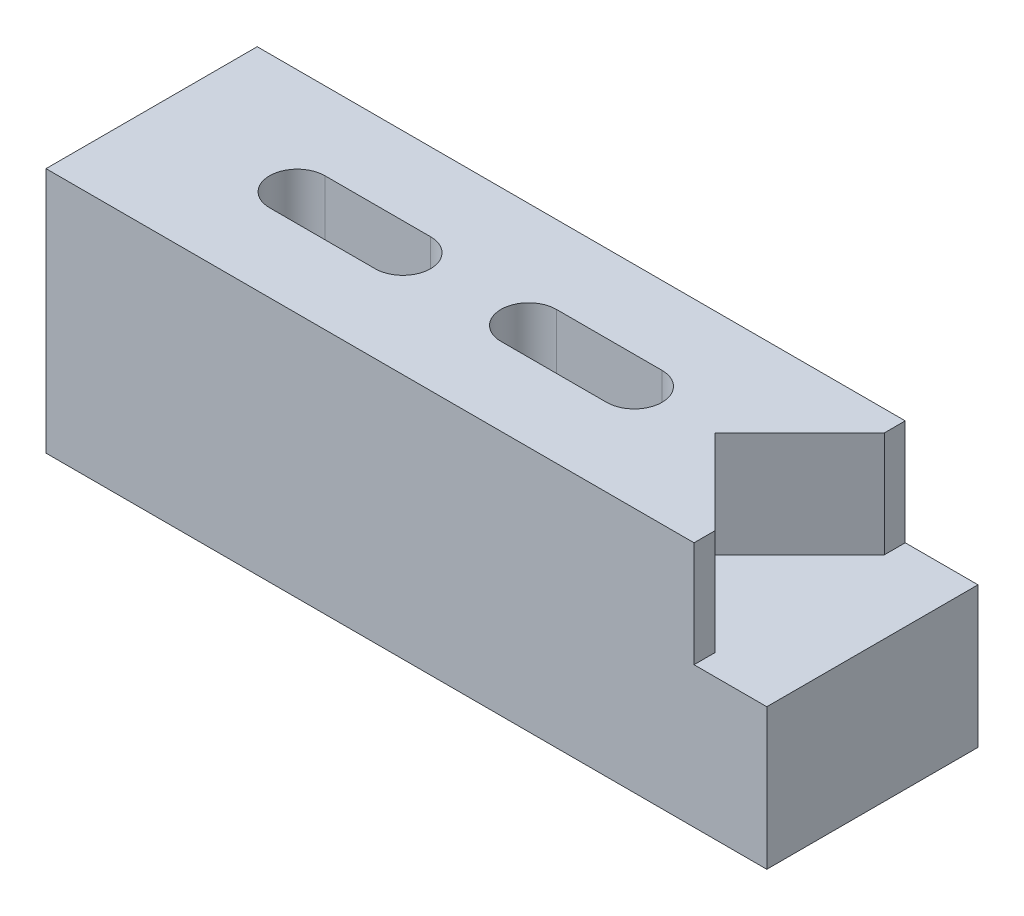
from build123d import *

# Parameters (mm, degrees)
SKETCH1_W           = 48.26
SKETCH1_H           = 17.78
BOSS_EXTRUDE1_DEPTH = 15.24
CUT_EXTRUDE1_DEPTH  = 7.62
CUT_EXTRUDE2_DEPTH  = 54.641528688
SKETCH5_W           = 15.24
SKETCH5_H           = 10.16
BOSS_EXTRUDE2_DEPTH = 3.75
CUT_EXTRUDE5_DEPTH  = 7.62
CUT_EXTRUDE7_DEPTH  = 7.62


with BuildPart() as part:
    # Sketch1 → Boss-Extrude1 (new body)
    with BuildSketch(Plane.XY):
        with Locations((24.13, 8.89)):
            Rectangle(SKETCH1_W, SKETCH1_H)
    extrude(amount=-BOSS_EXTRUDE1_DEPTH)

    # Sketch3 → Cut-Extrude1 (cut)
    with BuildSketch(Plane(origin=(0, 17.78, 0), x_dir=(1, 0, 0), z_dir=(0, 1, 0))):
        Polygon((48.26, 15.24), (40.64, 7.62), (48.26, 0), align=None)
    extrude(amount=-CUT_EXTRUDE1_DEPTH, mode=Mode.SUBTRACT)

    # Sketch4 → Cut-Extrude2 (cut, through all)
    with BuildSketch(Plane(origin=(0, 17.78, 0), x_dir=(1, 0, 0), z_dir=(0, 1, 0))):
        with BuildLine():
            Line((34.83, 5.62), (27.21, 5.62))
            ThreePointArc((27.21, 5.62), (25.21, 7.62), (27.21, 9.62))
            Line((27.21, 9.62), (34.83, 9.62))
            ThreePointArc((34.83, 9.62), (36.83, 7.62), (34.83, 5.62))
        make_face()
        with BuildLine():
            Line((18.13, 5.62), (10.51, 5.62))
            ThreePointArc((10.51, 5.62), (8.51, 7.62), (10.51, 9.62))
            Line((10.51, 9.62), (18.13, 9.62))
            ThreePointArc((18.13, 9.62), (20.13, 7.62), (18.13, 5.62))
        make_face()
    extrude(amount=-CUT_EXTRUDE2_DEPTH, mode=Mode.SUBTRACT)

    # Sketch5 → Boss-Extrude2 (add)
    with BuildSketch(Plane(origin=(48.26, 0, 0), x_dir=(0, 0, -1), z_dir=(1, 0, 0))):
        with Locations((7.62, 5.08)):
            Rectangle(SKETCH5_W, SKETCH5_H)
    extrude(amount=BOSS_EXTRUDE2_DEPTH)

    # Sketch6 → Cut-Extrude5 (cut)
    with BuildSketch(Plane(origin=(0, 17.78, 0), x_dir=(1, 0, 0), z_dir=(0, 1, 0))):
        Polygon((48.26, 0), (46.76, 0), (46.76, 1.5), align=None)
    extrude(amount=-CUT_EXTRUDE5_DEPTH, mode=Mode.SUBTRACT)

    # Sketch7 → Cut-Extrude7 (cut)
    with BuildSketch(Plane(origin=(0, 17.78, 0), x_dir=(1, 0, 0), z_dir=(0, 1, 0))):
        Polygon((48.26, 15.24), (46.76, 15.24), (46.76, 13.74), align=None)
    extrude(amount=-CUT_EXTRUDE7_DEPTH, mode=Mode.SUBTRACT)


solid = part.part
